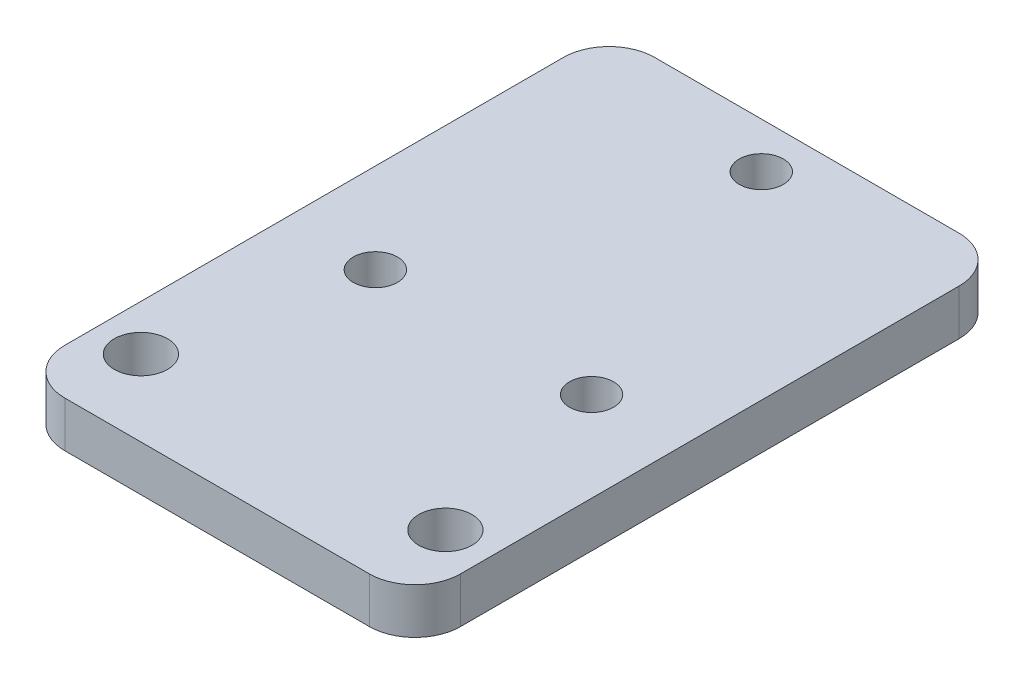
from build123d import *

# Parameters (mm, degrees)
SKETCH_1_R      = 1.75
SKETCH_1_R_2    = 1.45
EXTRUDE_1_DEPTH = 3
FILLET_1_R      = 3
EXTRUDE_2_DEPTH = 2.5
FILLET_2_R      = 1.5
FILLET_3_R      = 1


with BuildPart() as part:
    # 草图1 → 凸台-拉伸1 (new body)
    with BuildSketch(Plane(origin=(0, 0, 0), x_dir=(1, 0, 0), z_dir=(0, 1, 0))):
        Polygon((-13, 22.5), (-13, -12.5), (13, -12.5), (13, 22.5), (13, 26.25), (-13, 26.25), align=None)
        with Locations(Location((-10, -7.5, 0), (0, 0, 270))):
            Circle(SKETCH_1_R, mode=Mode.SUBTRACT)
        with Locations(Location((10, -7.5, 0), (0, 0, 270))):
            Circle(SKETCH_1_R, mode=Mode.SUBTRACT)
        with Locations(Location((0, 23.25, 0), (0, 0, 270))):
            Circle(SKETCH_1_R_2, mode=Mode.SUBTRACT)
        with Locations(Location((-7.1, 5, 0), (0, 0, 270))):
            Circle(SKETCH_1_R_2, mode=Mode.SUBTRACT)
        with Locations(Location((7.1, 5, 0), (0, 0, 270))):
            Circle(SKETCH_1_R_2, mode=Mode.SUBTRACT)
    extrude(amount=EXTRUDE_1_DEPTH)

    # 圆角1
    fillet_1_edges = [part.edges().sort_by_distance(p)[0] for p in [
        (13, 1.5, 12.5),
        (-13, 1.5, 12.5),
        (-13, 1.5, -26.25),
        (13, 1.5, -26.25),
    ]]
    fillet(fillet_1_edges, radius=FILLET_1_R)

    # 草图3 → 凸台-拉伸2 (add, symmetric)
    with BuildSketch(Plane(origin=(0, 0, 0), x_dir=(0, 0, -1), z_dir=(1, 0, 0))):
        Polygon((0, 0), (0, -10), (15.25, 0), align=None)
    extrude(amount=EXTRUDE_2_DEPTH, both=True)

    # 圆角2
    fillet_2_edges = [part.edges().sort_by_distance(p)[0] for p in [
        (-2.5, 0, -7.625),
        (0, 0, -15.25),
        (2.5, 0, -7.625),
    ]]
    fillet(fillet_2_edges, radius=FILLET_2_R)

    # 圆角3
    fillet_3_edges = [part.edges().sort_by_distance(p)[0] for p in [
        (0, -10, 0),
    ]]
    fillet(fillet_3_edges, radius=FILLET_3_R)


solid = part.part
